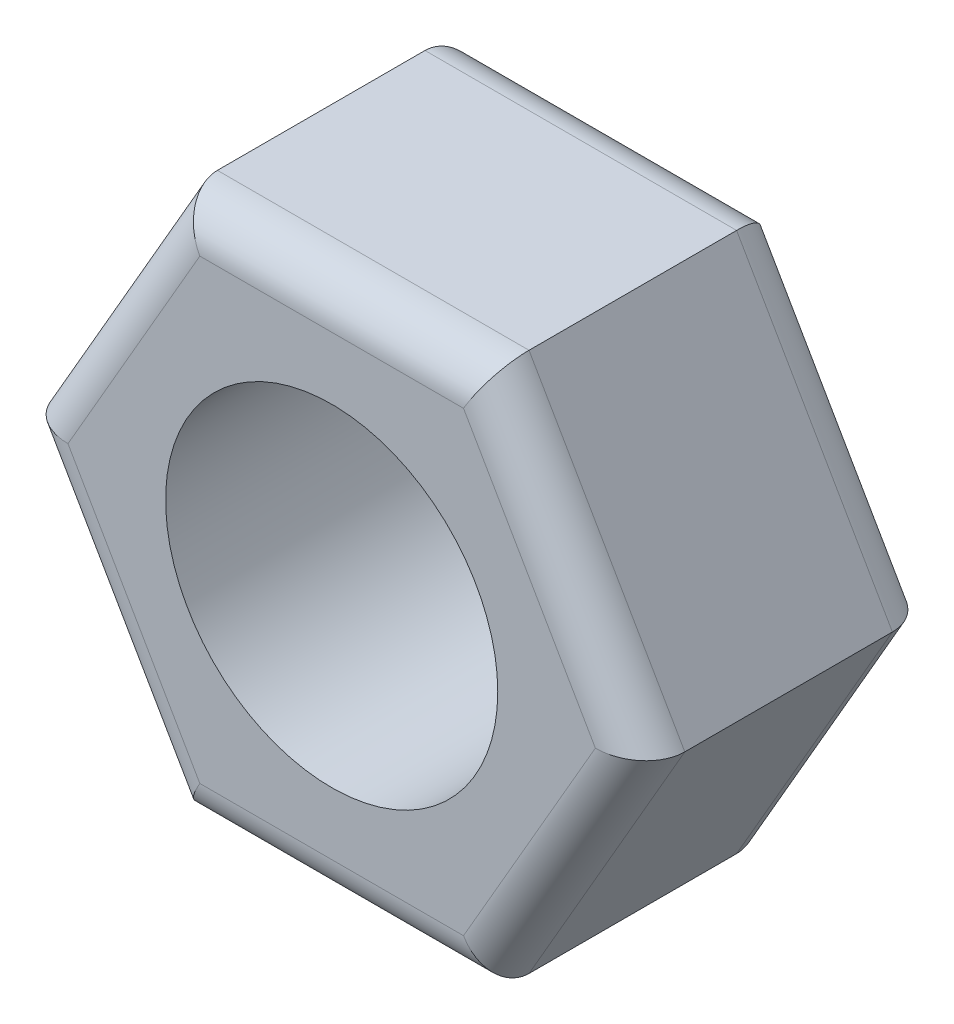
from build123d import *

# Parameters (mm, degrees)
SKETCH1_R           = 2
BOSS_EXTRUDE1_DEPTH = 3.5
FILLET1_R           = 0.5


with BuildPart() as part:
    # Sketch1 → Boss-Extrude1 (new body)
    with BuildSketch(Plane.XY):
        Polygon((-2.8145825622994267, 1.625000000000001), (-1.8763883748662844, 3.25), (0, 3.2500000000000004), (1.8763883748662837, 3.25), (2.8145825622994254, 1.6249999999999996), (3.752776749732567, -3.3e-16), (2.814582562299426, -1.6249999999999998), (1.876388374866284, -3.25), (0, -3.2500000000000004), (-1.876388374866284, -3.25), (-2.814582562299426, -1.6249999999999993), (-3.752776749732568, 8.7e-16), align=None)
        Circle(SKETCH1_R, mode=Mode.SUBTRACT)
    extrude(amount=BOSS_EXTRUDE1_DEPTH)

    # Fillet1
    fillet1_edges = [part.edges().sort_by_distance(p)[0] for p in [
        (-2.8145825622994263, 1.6250000000000004, 0),
        (-4.4e-16, 3.25, 0),
        (2.8145825622994254, 1.625, 0),
        (2.8145825622994254, -1.6250000000000002, 0),
        (0, -3.25, 3.5),
        (0, -3.25, 0),
        (-2.814582562299426, -1.6249999999999996, 0),
        (2.8145825622994254, -1.625, 3.5),
        (2.8145825622994254, 1.6249999999999998, 3.5),
        (-2.2e-16, 3.25, 3.5),
        (-2.8145825622994263, 1.6250000000000004, 3.5),
        (-2.814582562299426, -1.6249999999999996, 3.5),
    ]]
    fillet(fillet1_edges, radius=FILLET1_R)


solid = part.part
